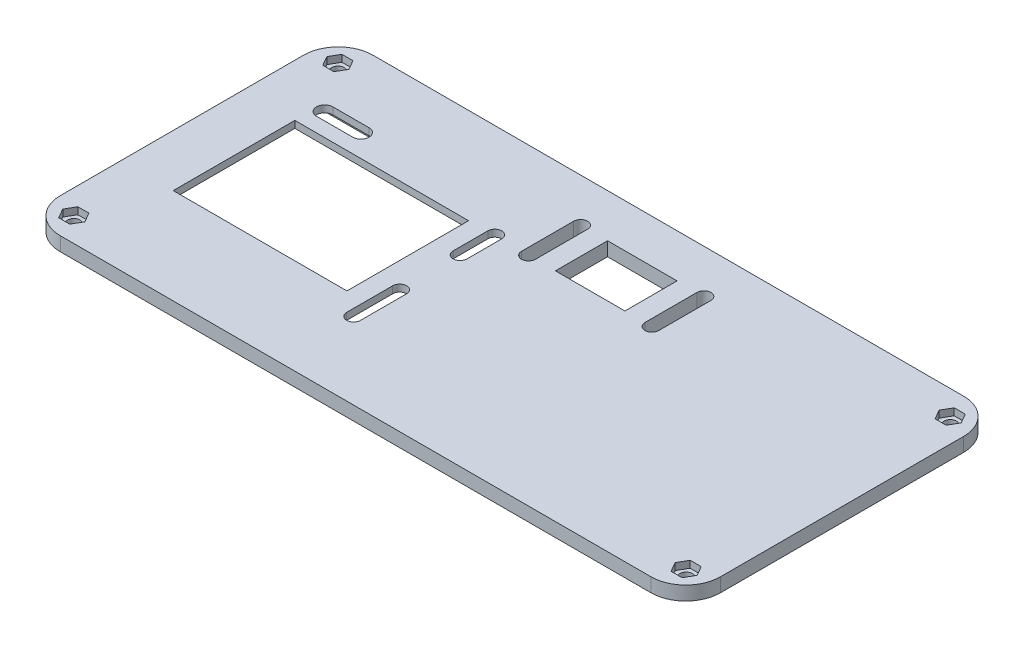
from build123d import *

# Parameters (mm, degrees)
SKETCH1_W               = 190
SKETCH1_H               = 90
BOSS_EXTRUDE1_DEPTH     = 4
SKETCH2_R               = 1.75
CUT_EXTRUDE8_DEPTH      = 2
SKETCH14_R              = 1.75
CUT_EXTRUDE9_DEPTH      = 4
MIRROR9_COPY_1_SKETCH_R = 1.75
MIRROR9_COPY_1_DEPTH    = 2
MIRROR9_COPY_2_SKETCH_R = 1.75
MIRROR9_COPY_2_DEPTH    = 4
SKETCH16_W              = 70.6
SKETCH16_H              = 56
CUT_EXTRUDE10_DEPTH     = 2
CUT_EXTRUDE11_DEPTH     = 4
SKETCH18_W              = 50
SKETCH18_H              = 35
CUT_EXTRUDE12_DEPTH     = 4
SKETCH19_W              = 9
SKETCH19_H              = 21.5
BOSS_EXTRUDE2_DEPTH     = 2
CUT_EXTRUDE13_DEPTH     = 6
FILLET1_R               = 10
SKETCH21_W              = 4.7
SKETCH21_H              = 13
CUT_EXTRUDE14_DEPTH     = 2
SKETCH22_W              = 20
SKETCH22_H              = 15
CUT_EXTRUDE15_DEPTH     = 4
SKETCH23_W              = 4.7
SKETCH23_H              = 11
CUT_EXTRUDE16_DEPTH     = 2


with BuildPart() as part:
    # Sketch1 → Boss-Extrude1 (new body)
    with BuildSketch(Plane(origin=(0, 0, 0), x_dir=(1, 0, 0), z_dir=(0, 1, 0))):
        Rectangle(SKETCH1_W, SKETCH1_H)
    extrude(amount=BOSS_EXTRUDE1_DEPTH)

    # Sketch2 → Cut-Extrude8 (cut)
    with BuildSketch(Plane(origin=(0, 4, 0), x_dir=(1, 0, 0), z_dir=(0, 1, 0))):
        Polygon((-84.935953931, 38), (-86.525120789, 40.752517739), (-89.703454503, 40.752517739), (-91.292621361, 38), (-89.703454503, 35.247482261), (-86.525120789, 35.247482261), align=None)
        with Locations(Location((-88.114287646, 38, 0), (0, 0, 270))):
            Circle(SKETCH2_R, mode=Mode.SUBTRACT)
    cut_extrude8 = extrude(amount=-CUT_EXTRUDE8_DEPTH, mode=Mode.SUBTRACT)

    # Sketch14 → Cut-Extrude9 (cut)
    with BuildSketch(Plane(origin=(0, 4, 0), x_dir=(1, 0, 0), z_dir=(0, 1, 0))):
        with Locations(Location((-88.114287646, 38, 0), (0, 0, 270))):
            Circle(SKETCH14_R)
    cut_extrude9 = extrude(amount=-CUT_EXTRUDE9_DEPTH, mode=Mode.SUBTRACT)

    # Mirror8: Cut-Extrude8, Cut-Extrude9 across plane
    add(cut_extrude8.mirror(Plane.XY), mode=Mode.SUBTRACT)
    add(cut_extrude9.mirror(Plane.XY), mode=Mode.SUBTRACT)

    # Mirror9: Cut-Extrude8, Cut-Extrude9 across plane
    add(cut_extrude8.mirror(Plane(origin=(0, 0, 0), x_dir=(0, 0, 1), z_dir=(1, 0, 0))), mode=Mode.SUBTRACT)
    add(cut_extrude9.mirror(Plane(origin=(0, 0, 0), x_dir=(0, 0, 1), z_dir=(1, 0, 0))), mode=Mode.SUBTRACT)

    # Mirror9 copy 1 sketch → Mirror9 copy 1 (cut)
    with BuildSketch(Plane(origin=(0, 4, 0), x_dir=(-1, 0, 0), z_dir=(0, 1, 0))):
        Polygon((-84.935953931, 38), (-86.525120789, 40.752517739), (-89.703454503, 40.752517739), (-91.292621361, 38), (-89.703454503, 35.247482261), (-86.525120789, 35.247482261), align=None)
        with Locations(Location((-88.114287646, 38, 0), (0, 0, 270))):
            Circle(MIRROR9_COPY_1_SKETCH_R, mode=Mode.SUBTRACT)
    extrude(amount=-MIRROR9_COPY_1_DEPTH, mode=Mode.SUBTRACT)

    # Mirror9 copy 2 sketch → Mirror9 copy 2 (cut)
    with BuildSketch(Plane(origin=(0, 4, 0), x_dir=(-1, 0, 0), z_dir=(0, 1, 0))):
        with Locations(Location((-88.114287646, 38, 0), (0, 0, 270))):
            Circle(MIRROR9_COPY_2_SKETCH_R)
    extrude(amount=-MIRROR9_COPY_2_DEPTH, mode=Mode.SUBTRACT)

    # Sketch16 → Cut-Extrude10 (cut)
    with BuildSketch(Plane.XZ):
        with Locations((-55, 0)):
            Rectangle(SKETCH16_W, SKETCH16_H)
    extrude(amount=-CUT_EXTRUDE10_DEPTH, mode=Mode.SUBTRACT)

    # Sketch17 → Cut-Extrude11 (cut)
    with BuildSketch(Plane.XZ.offset(-2)):
        with BuildLine():
            Line((-77.910700379, -21.65), (-67.489299621, -21.65))
            ThreePointArc((-67.489299621, -21.65), (-65.139299621, -24), (-67.489299621, -26.35))
            Line((-67.489299621, -26.35), (-77.910700379, -26.35))
            ThreePointArc((-77.910700379, -26.35), (-80.260700379, -24), (-77.910700379, -21.65))
        make_face()
        with BuildLine():
            Line((-24.7, -17.749516727), (-24.7, -7.749516727))
            ThreePointArc((-24.7, -7.749516727), (-22.7, -5.749516727), (-20.7, -7.749516727))
            Line((-20.7, -7.749516727), (-20.7, -17.749516727))
            ThreePointArc((-20.7, -17.749516727), (-22.7, -19.749516727), (-24.7, -17.749516727))
        make_face()
        with BuildLine():
            Line((-20.7, 22.876592803), (-20.7, 9.624373743))
            ThreePointArc((-20.7, 9.624373743), (-22.7, 7.624373743), (-24.7, 9.624373743))
            Line((-24.7, 9.624373743), (-24.7, 22.876592803))
            ThreePointArc((-24.7, 22.876592803), (-22.7, 24.876592803), (-20.7, 22.876592803))
        make_face()
    extrude(amount=-CUT_EXTRUDE11_DEPTH, mode=Mode.SUBTRACT)

    # Sketch18 → Cut-Extrude12 (cut)
    with BuildSketch(Plane.XZ.offset(-2)):
        with Locations((-55, 0)):
            Rectangle(SKETCH18_W, SKETCH18_H)
    extrude(amount=-CUT_EXTRUDE12_DEPTH, mode=Mode.SUBTRACT)

    # Sketch19 → Boss-Extrude2 (add)
    with BuildSketch(Plane.XZ):
        with Locations((-12.75, -25)):
            Rectangle(SKETCH19_W, SKETCH19_H)
        with Locations((22.75, -25)):
            Rectangle(SKETCH19_W, SKETCH19_H)
    extrude(amount=BOSS_EXTRUDE2_DEPTH)

    # Sketch20 → Cut-Extrude13 (cut)
    with BuildSketch(Plane.XZ.offset(2)):
        with BuildLine():
            Line((-14.75, -32.5), (-14.75, -17.5))
            ThreePointArc((-14.75, -17.5), (-12.75, -15.5), (-10.75, -17.5))
            Line((-10.75, -17.5), (-10.75, -32.5))
            ThreePointArc((-10.75, -32.5), (-12.75, -34.5), (-14.75, -32.5))
        make_face()
        with BuildLine():
            Line((24.75, -32.5), (24.75, -17.5))
            ThreePointArc((24.75, -17.5), (22.75, -15.5), (20.75, -17.5))
            Line((20.75, -17.5), (20.75, -32.5))
            ThreePointArc((20.75, -32.5), (22.75, -34.5), (24.75, -32.5))
        make_face()
    extrude(amount=-CUT_EXTRUDE13_DEPTH, mode=Mode.SUBTRACT)

    # Fillet1
    fillet1_edges = [part.edges().sort_by_distance(p)[0] for p in [
        (-95, 2, 45),
        (-95, 2, -45),
        (95, 2, -45),
        (95, 2, 45),
    ]]
    fillet(fillet1_edges, radius=FILLET1_R)

    # Sketch21 → Cut-Extrude14 (cut)
    with BuildSketch(Plane.XZ):
        with Locations((-92.65, 12.5)):
            Rectangle(SKETCH21_W, SKETCH21_H)
    extrude(amount=-CUT_EXTRUDE14_DEPTH, mode=Mode.SUBTRACT)

    # Sketch22 → Cut-Extrude15 (cut)
    with BuildSketch(Plane.XZ):
        with Locations((5, -25)):
            Rectangle(SKETCH22_W, SKETCH22_H)
    extrude(amount=-CUT_EXTRUDE15_DEPTH, mode=Mode.SUBTRACT)

    # Sketch23 → Cut-Extrude16 (cut)
    with BuildSketch(Plane.XZ):
        with Locations((-92.65, -17.5)):
            Rectangle(SKETCH23_W, SKETCH23_H)
    extrude(amount=-CUT_EXTRUDE16_DEPTH, mode=Mode.SUBTRACT)


solid = part.part
